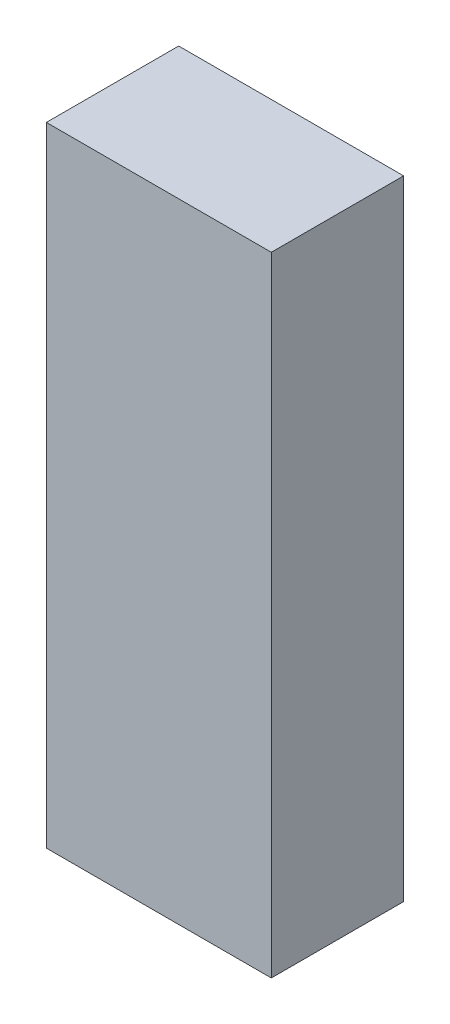
from build123d import *

# Parameters (mm, degrees)
SKETCH1_W           = 95
SKETCH1_H           = 34
BOSS_EXTRUDE1_DEPTH = 20


with BuildPart() as part:
    # Sketch1 → Boss-Extrude1 (new body)
    with BuildSketch(Plane(origin=(0, 0, 0), x_dir=(0, 1, 0), z_dir=(0, 0, 1))):
        with Locations((47.5, 17)):
            Rectangle(SKETCH1_W, SKETCH1_H)
    extrude(amount=BOSS_EXTRUDE1_DEPTH)


solid = part.part
